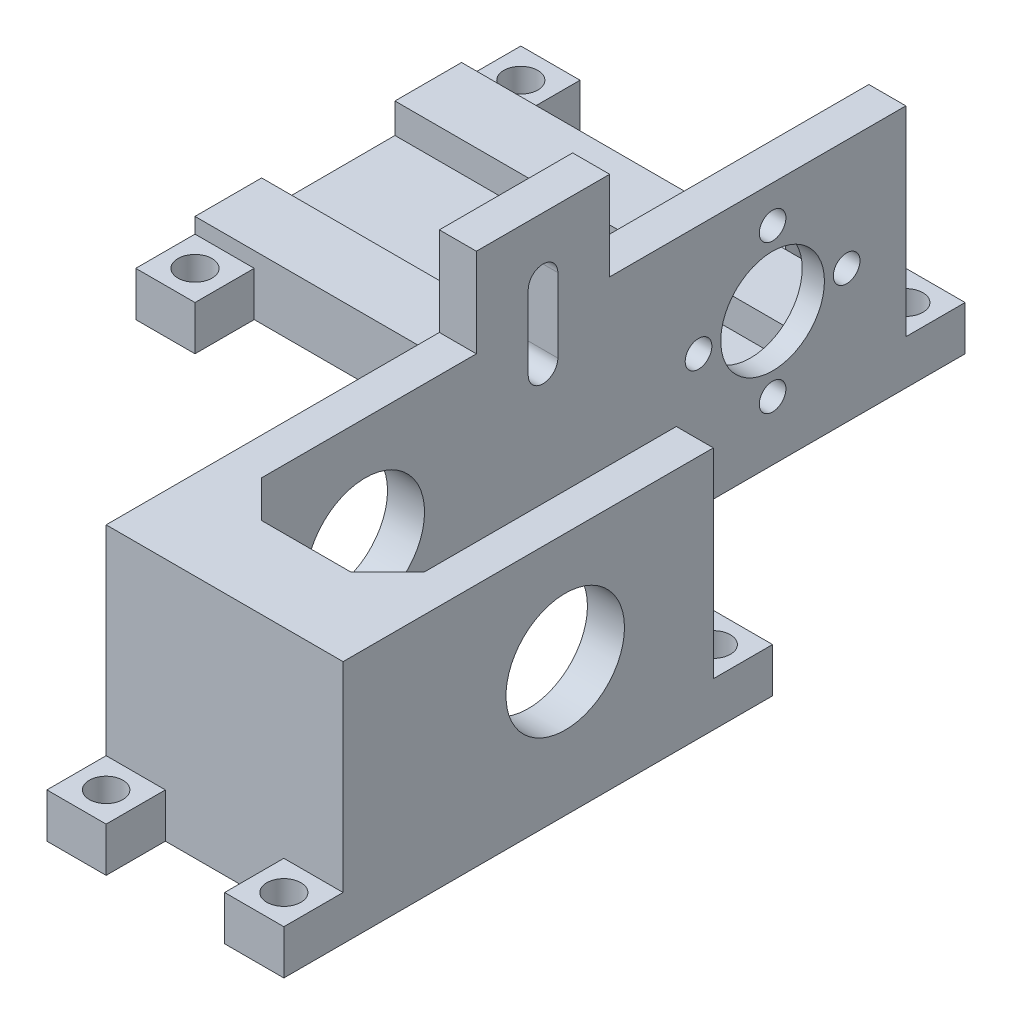
from build123d import *

# Parameters (mm, degrees)
BOSS_EXTRU_1_DEPTH      = 45
ESQUISSE2_R             = 8
ENL_V_MAT_EXTRU_1_DEPTH = 50
ENL_V_MAT_EXTRU_2_DEPTH = 50
ESQUISSE4_R             = 1.8
ESQUISSE4_R_2           = 7
ENL_V_MAT_EXTRU_3_DEPTH = 5
BOSS_EXTRU_2_DEPTH      = 60
BOSS_EXTRU_3_DEPTH      = 45
ESQUISSE11_W            = 8
ESQUISSE11_H            = 8
ESQUISSE11_R            = 2.3
ESQUISSE11_R_2          = 2.268048231
BOSS_EXTRU_6_DEPTH      = 6
ESQUISSE12_W            = 40
ESQUISSE12_H            = 12
ESQUISSE12_W_2          = 45
ENL_V_MAT_EXTRU_5_DEPTH = 50
ESQUISSE13_W            = 5
ESQUISSE13_H            = 12
ENL_V_MAT_EXTRU_6_DEPTH = 20
ESQUISSE25_R            = 13.4
ENL_V_MAT_EXTRU_8_DEPTH = 2


with BuildPart() as part:
    # Esquisse1 → Boss.-Extru.1 (new body)
    with BuildSketch(Plane(origin=(0, 0, 0), x_dir=(1, 0, 0), z_dir=(0, 1, 0))):
        Polygon((-15, 0), (17, 0), (17, 50), (12, 50), (12, 6), (-10, 6), (-10, 103), (-15, 103), align=None)
    extrude(amount=BOSS_EXTRU_1_DEPTH)

    # Esquisse2 → Enlèv. mat.-Extru.1 (cut)
    with BuildSketch(Plane(origin=(17, 0, 0), x_dir=(0, 0, -1), z_dir=(1, 0, 0))):
        with Locations((30, 18)):
            Circle(ESQUISSE2_R)
    extrude(amount=-ENL_V_MAT_EXTRU_1_DEPTH, mode=Mode.SUBTRACT)

    # Esquisse3 → Enlèv. mat.-Extru.2 (cut)
    with BuildSketch(Plane.ZY.offset(15)):
        with BuildLine():
            ThreePointArc((-52, 37), (-54, 39), (-56, 37))
            Line((-56, 37), (-56, 27))
            ThreePointArc((-56, 27), (-54, 25), (-52, 27))
            Line((-52, 27), (-52, 37))
        make_face()
    extrude(amount=-ENL_V_MAT_EXTRU_2_DEPTH, mode=Mode.SUBTRACT)

    # Esquisse4 → Enlèv. mat.-Extru.3 (cut)
    with BuildSketch(Plane(origin=(-10, 0, 0), x_dir=(0, 0, -1), z_dir=(1, 0, 0))):
        with Locations((75, 18)):
            Circle(ESQUISSE4_R)
        with Locations((85, 8)):
            Circle(ESQUISSE4_R)
        with Locations((95, 18)):
            Circle(ESQUISSE4_R)
        with Locations((85, 28)):
            Circle(ESQUISSE4_R)
        with Locations((85, 18)):
            Circle(ESQUISSE4_R_2)
    extrude(amount=-ENL_V_MAT_EXTRU_3_DEPTH, mode=Mode.SUBTRACT)

    # Esquisse4<4> → Boss.-Extru.2 (add)
    with BuildSketch(Plane(origin=(-10, 0, 0), x_dir=(0, 0, -1), z_dir=(1, 0, 0))):
        Polygon((103, 0), (103, 8.072261083), (94, 8.072261083), (94, 4.036130542), (76, 4), (76, 8.072261083), (67, 8.072261083), (67, 0), align=None)
    extrude(amount=-BOSS_EXTRU_2_DEPTH)

    # Esquisse6 → Boss.-Extru.3 (add)
    with BuildSketch(Plane.XZ):
        Polygon((-5, -6), (-10, -6), (-10, -16), (-5, -11), (7, -11), (12, -16), (12, -6), (7, -6), align=None)
    extrude(amount=-BOSS_EXTRU_3_DEPTH)

    # Esquisse11 → Boss.-Extru.6 (add)
    # profile 1 of 7: a face of its own
    with BuildSketch(Plane.XZ):
        with Locations((13, 4)):
            Rectangle(ESQUISSE11_W, ESQUISSE11_H)
        with Locations((13, 4)):
            Circle(ESQUISSE11_R, mode=Mode.SUBTRACT)
    # profile 2 of 7: a face of its own
    with BuildSketch(Plane.XZ):
        with Locations((-11, 4)):
            Rectangle(ESQUISSE11_W, ESQUISSE11_H)
        with Locations((-11, 4)):
            Circle(ESQUISSE11_R_2, mode=Mode.SUBTRACT)
    # profile 3 of 7: a face of its own
    with BuildSketch(Plane.XZ):
        Polygon((17, -58), (17, -50), (12, -50), (12, -46), (9, -46), (9, -58), align=None)
        with Locations((13, -54)):
            Circle(ESQUISSE11_R, mode=Mode.SUBTRACT)
    # profile 4 of 7: a face of its own
    with BuildSketch(Plane.XZ):
        with Locations((-66, -63)):
            Rectangle(ESQUISSE11_W, ESQUISSE11_H)
        with Locations((-66, -63)):
            Circle(ESQUISSE11_R, mode=Mode.SUBTRACT)
    # profile 5 of 7: a face of its own
    with BuildSketch(Plane.XZ):
        with Locations((-66, -107)):
            Rectangle(ESQUISSE11_W, ESQUISSE11_H)
        with Locations((-66, -107)):
            Circle(ESQUISSE11_R, mode=Mode.SUBTRACT)
    # profile 6 of 7: a face of its own
    with BuildSketch(Plane.XZ):
        with Locations((-27, -107)):
            Rectangle(ESQUISSE11_W, ESQUISSE11_H)
        with Locations((-27, -107)):
            Circle(ESQUISSE11_R, mode=Mode.SUBTRACT)
    # profile 7 of 7: a face of its own
    with BuildSketch(Plane.XZ):
        with Locations((-14, -107)):
            Rectangle(ESQUISSE11_W, ESQUISSE11_H)
        with Locations((-14, -107)):
            Circle(ESQUISSE11_R, mode=Mode.SUBTRACT)
    extrude(amount=-BOSS_EXTRU_6_DEPTH)

    # Esquisse12 → Enlèv. mat.-Extru.5 (cut)
    with BuildSketch(Plane.ZY.offset(15)):
        with Locations((-83, 39)):
            Rectangle(ESQUISSE12_W, ESQUISSE12_H)
        with Locations((-22.5, 39)):
            Rectangle(ESQUISSE12_W_2, ESQUISSE12_H)
    extrude(amount=-ENL_V_MAT_EXTRU_5_DEPTH, mode=Mode.SUBTRACT)

    # Esquisse13 → Enlèv. mat.-Extru.6 (cut)
    with BuildSketch(Plane(origin=(17, 0, 0), x_dir=(0, 0, -1), z_dir=(1, 0, 0))):
        with Locations((47.5, 39)):
            Rectangle(ESQUISSE13_W, ESQUISSE13_H)
    extrude(amount=-ENL_V_MAT_EXTRU_6_DEPTH, mode=Mode.SUBTRACT)

    # Esquisse25 → Enlèv. mat.-Extru.8 (cut)
    with BuildSketch(Plane.ZY.offset(15)):
        with Locations((-85, 18)):
            Circle(ESQUISSE25_R)
    extrude(amount=-ENL_V_MAT_EXTRU_8_DEPTH, mode=Mode.SUBTRACT)


solid = part.part
